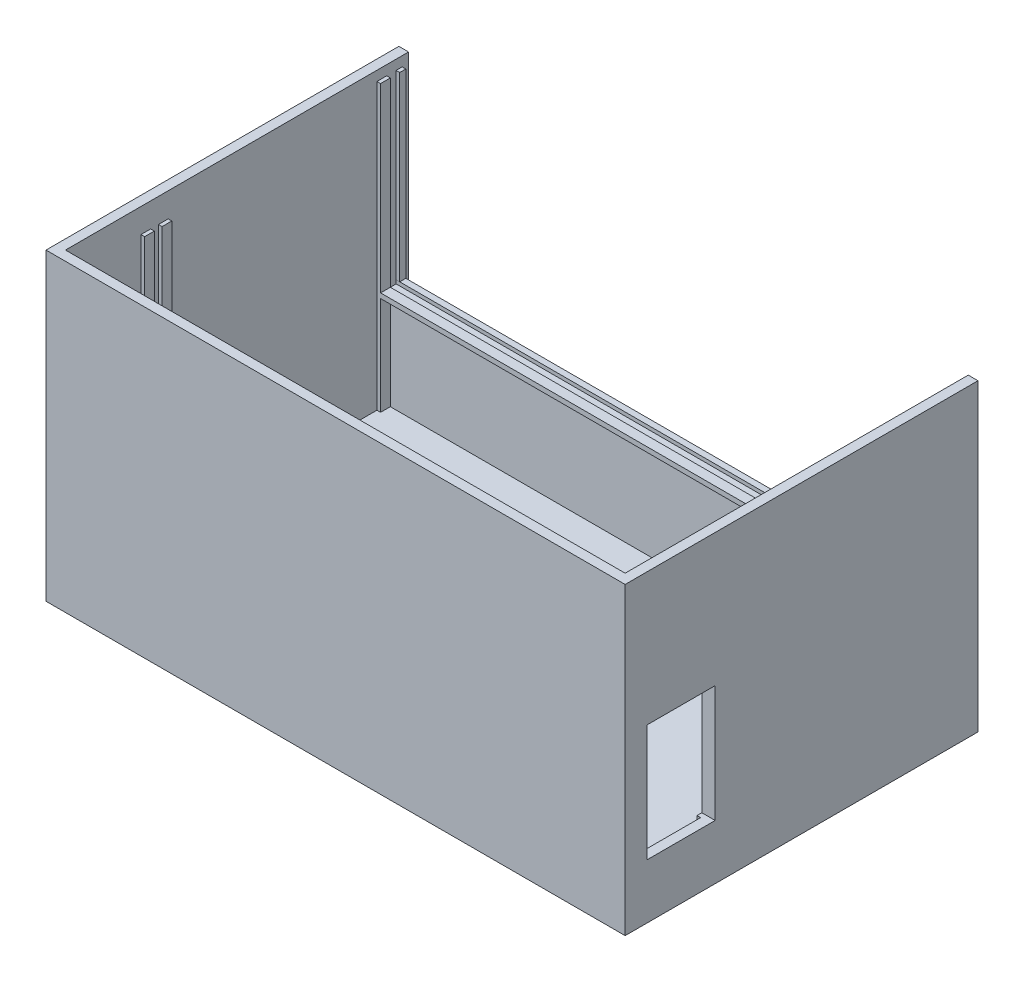
from build123d import *

# Parameters (mm, degrees)
SKETCH_1_W          = 238
SKETCH_1_H          = 140
EXTRUDE_3_DEPTH     = 125
SHELL_1_T           = -4
SKETCH_2_W          = 230
SKETCH_2_H          = 80
CUT_EXTRUDE_1_DEPTH = 120
SKETCH_5_W          = 4
SKETCH_5_H          = 117
EXTRUDE_6_DEPTH     = 1.5
SKETCH_6_W          = 4
SKETCH_6_H          = 117
EXTRUDE_7_DEPTH     = 1.5
EXTRUDE_8_DEPTH     = 5
EXTRUDE_9_DEPTH     = 230
EXTRUDE_10_DEPTH    = 227
SKETCH_10_W         = 2.5
SKETCH_10_H         = 74.5
EXTRUDE_11_DEPTH    = 1.5
SKETCH_11_W         = 2.5
SKETCH_11_H         = 74.5
EXTRUDE_12_DEPTH    = 1.5
SKETCH_12_W         = 4
SKETCH_12_H         = 111
EXTRUDE_14_DEPTH    = 1.5
SKETCH_13_W         = 2
SKETCH_13_H         = 111
SKETCH_13_W_2       = 4
EXTRUDE_17_DEPTH    = 1.5
SKETCH_14_W         = 28
SKETCH_14_H         = 48
CUT_EXTRUDE_3_DEPTH = 18
SKETCH_15_W         = 30
SKETCH_15_H         = 22
CUT_EXTRUDE_4_DEPTH = 18
SKETCH_16_W         = 2
SKETCH_16_H         = 111
EXTRUDE_18_DEPTH    = 1.5
SKETCH_17_W         = 4
SKETCH_17_H         = 111
EXTRUDE_19_DEPTH    = 1.5
SKETCH_19_W         = 4
SKETCH_19_H         = 111
EXTRUDE_20_DEPTH    = 1.5
SKETCH_20_W         = 4
SKETCH_20_H         = 111
EXTRUDE_21_DEPTH    = 1.5


with BuildPart() as part:
    # 草图1 → 凸台-拉伸3 (new body)
    with BuildSketch(Plane(origin=(0, 0, 0), x_dir=(1, 0, 0), z_dir=(0, 1, 0))):
        with Locations((32.875338753, -3.224932249)):
            Rectangle(SKETCH_1_W, SKETCH_1_H)
    extrude(amount=EXTRUDE_3_DEPTH)

    # 抽壳1
    shell_1_openings = [part.faces().sort_by_distance(p)[0] for p in [
        (32.875338753, 125, 3.224932249),
    ]]
    offset(amount=SHELL_1_T, openings=shell_1_openings, kind=Kind.INTERSECTION)

    # 草图2 → 切除-拉伸1 (cut)
    with BuildSketch(Plane.XY.offset(-62.775067751)):
        with Locations((32.875338753, 85)):
            Rectangle(SKETCH_2_W, SKETCH_2_H)
    extrude(amount=-CUT_EXTRUDE_1_DEPTH, mode=Mode.SUBTRACT)

    # 草图5 → 凸台-拉伸6 (add)
    with BuildSketch(Plane.ZY.offset(-147.875338753)):
        with Locations((-60.775067751, 62.5)):
            Rectangle(SKETCH_5_W, SKETCH_5_H)
    extrude(amount=EXTRUDE_6_DEPTH)

    # 草图6 → 凸台-拉伸7 (add)
    with BuildSketch(Plane(origin=(-82.124661247, 0, 0), x_dir=(0, 0, -1), z_dir=(1, 0, 0))):
        with Locations((60.775067751, 62.5)):
            Rectangle(SKETCH_6_W, SKETCH_6_H)
    extrude(amount=EXTRUDE_7_DEPTH)

    # 草图7 → 凸台-拉伸8 (add)
    with BuildSketch(Plane(origin=(0, 0, -66.775067751), x_dir=(-1, 0, 0), z_dir=(0, 0, -1))):
        Polygon((-151.875338753, 125), (-147.875338753, 125), (-147.875338753, 4), (82.124661247, 4), (82.124661247, 125), (86.124661247, 125), (86.124661247, 0), (-151.875338753, 0), align=None)
    extrude(amount=EXTRUDE_8_DEPTH)

    # 草图8 → 凸台-拉伸9 (add)
    with BuildSketch(Plane.ZY.offset(-147.875338753)):
        Polygon((-66.645720039, 46.5), (-66.775067751, 37.387932584), (-69.145720039, 45), (-69.145720039, 46.5), align=None)
    extrude(amount=EXTRUDE_9_DEPTH)

    # 草图9 → 凸台-拉伸10 (add)
    with BuildSketch(Plane.ZY.offset(-146.375338753)):
        Polygon((-62.775067751, 46.5), (-58.775067751, 46.5), (-58.775067751, 44.5), (-62.775067751, 43), align=None)
    extrude(amount=EXTRUDE_10_DEPTH)

    # 草图10 → 凸台-拉伸11 (add)
    with BuildSketch(Plane.ZY.offset(-147.875338753)):
        with Locations((-67.895720039, 83.75)):
            Rectangle(SKETCH_10_W, SKETCH_10_H)
    extrude(amount=EXTRUDE_11_DEPTH)

    # 草图11 → 凸台-拉伸12 (add)
    with BuildSketch(Plane(origin=(-82.124661247, 0, 0), x_dir=(0, 0, -1), z_dir=(1, 0, 0))):
        with Locations((67.895720039, 83.75)):
            Rectangle(SKETCH_11_W, SKETCH_11_H)
    extrude(amount=EXTRUDE_12_DEPTH)

    # 草图12 → 凸台-拉伸14 (add)
    with BuildSketch(Plane.ZY.offset(-147.875338753)):
        with Locations((36.224932249, 59.5)):
            Rectangle(SKETCH_12_W, SKETCH_12_H)
        with Locations((29.024932249, 59.5)):
            Rectangle(SKETCH_12_W, SKETCH_12_H)
    extrude(amount=EXTRUDE_14_DEPTH)

    # 草图13 → 凸台-拉伸17 (add)
    with BuildSketch(Plane.ZY.offset(-147.875338753)):
        with Locations((68.224932249, 59.5)):
            Rectangle(SKETCH_13_W, SKETCH_13_H)
        with Locations((62.224932249, 59.5)):
            Rectangle(SKETCH_13_W_2, SKETCH_13_H)
    extrude(amount=EXTRUDE_17_DEPTH)

    # 草图14 → 切除-拉伸3 (cut)
    with BuildSketch(Plane.ZY.offset(-146.375338753)):
        with Locations((50.224932249, 46.5)):
            Rectangle(SKETCH_14_W, SKETCH_14_H)
    extrude(amount=-CUT_EXTRUDE_3_DEPTH, mode=Mode.SUBTRACT)

    # 草图15 → 切除-拉伸4 (cut)
    with BuildSketch(Plane(origin=(0, 0, -66.775067751), x_dir=(-1, 0, 0), z_dir=(0, 0, -1))):
        with Locations((-117.875338753, 20.693966292)):
            Rectangle(SKETCH_15_W, SKETCH_15_H)
        with Locations((-72.875338753, 20.693966292)):
            Rectangle(SKETCH_15_W, SKETCH_15_H)
    extrude(amount=-CUT_EXTRUDE_4_DEPTH, mode=Mode.SUBTRACT)

    # 草图16 → 凸台-拉伸18 (add)
    with BuildSketch(Plane(origin=(-82.124661247, 0, 0), x_dir=(0, 0, -1), z_dir=(1, 0, 0))):
        with Locations((-68.224932249, 59.5)):
            Rectangle(SKETCH_16_W, SKETCH_16_H)
    extrude(amount=EXTRUDE_18_DEPTH)

    # 草图17 → 凸台-拉伸19 (add)
    with BuildSketch(Plane(origin=(-82.124661247, 0, 0), x_dir=(0, 0, -1), z_dir=(1, 0, 0))):
        with Locations((-62.224932249, 59.5)):
            Rectangle(SKETCH_17_W, SKETCH_17_H)
    extrude(amount=EXTRUDE_19_DEPTH)

    # 草图19 → 凸台-拉伸20 (add)
    with BuildSketch(Plane(origin=(-82.124661247, 0, 0), x_dir=(0, 0, -1), z_dir=(1, 0, 0))):
        with Locations((-36.224932249, 59.5)):
            Rectangle(SKETCH_19_W, SKETCH_19_H)
    extrude(amount=EXTRUDE_20_DEPTH)

    # 草图20 → 凸台-拉伸21 (add)
    with BuildSketch(Plane(origin=(-82.124661247, 0, 0), x_dir=(0, 0, -1), z_dir=(1, 0, 0))):
        with Locations((-29.024932249, 59.5)):
            Rectangle(SKETCH_20_W, SKETCH_20_H)
    extrude(amount=EXTRUDE_21_DEPTH)


solid = part.part
